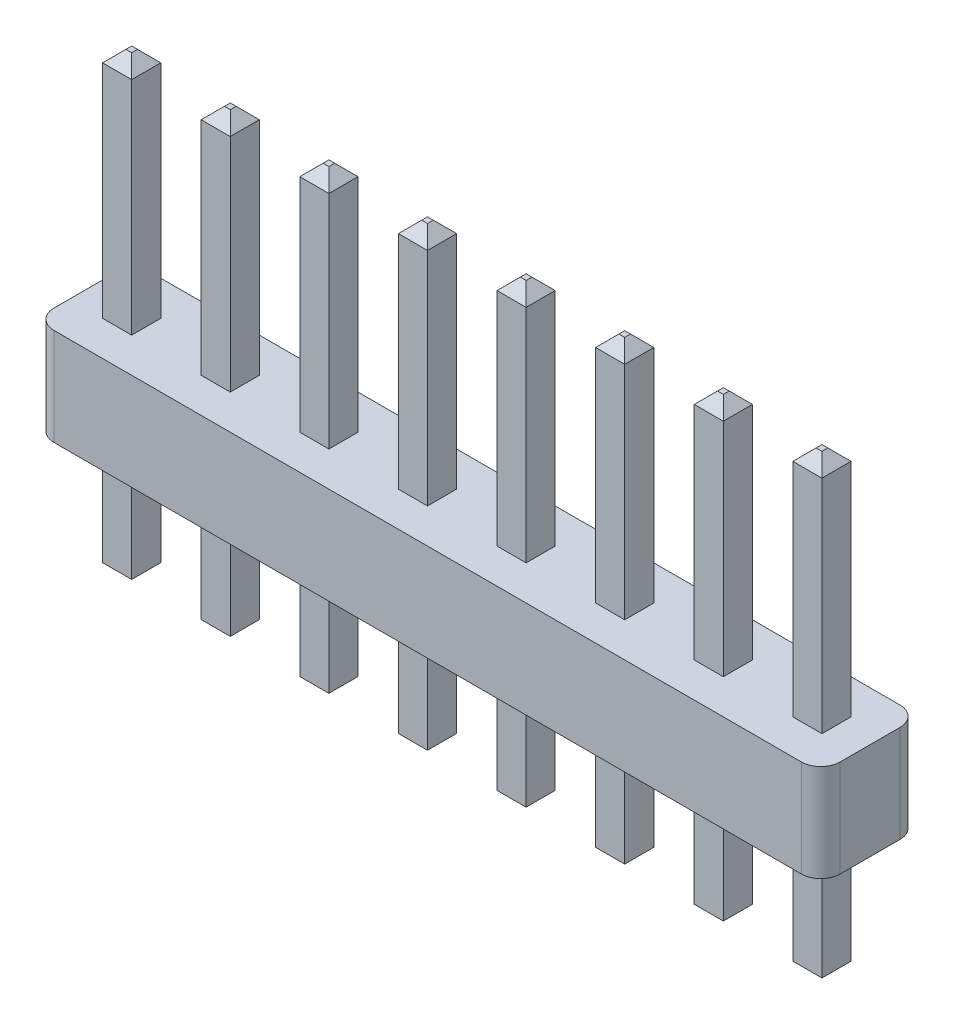
from build123d import *

# Parameters (mm, degrees)
BOSS_EXTRUDE1_DEPTH      = 2.5
BOSS_EXTRUDE2_DEPTH      = 8.5
BOSS_EXTRUDE2_DEPTH_BACK = 3.25
SKETCH2_W                = 0.75
SKETCH2_H                = 0.75
CHAMFER1_SIZE            = 0.3


with BuildPart() as part:
    # Sketch1 → Boss-Extrude1 (new body)
    with BuildSketch(Plane(origin=(0, 0, 0), x_dir=(-1, 0, 0), z_dir=(0, 1, 0))):
        with BuildLine():
            Line((-17.25, 1.27), (2, 1.27))
            ThreePointArc((2, 1.27), (2.353553391, 1.123553391), (2.5, 0.77))
            Line((2.5, 0.77), (2.5, -0.77))
            ThreePointArc((2.5, -0.77), (2.353553391, -1.123553391), (2, -1.27))
            Line((2, -1.27), (-17.25, -1.27))
            ThreePointArc((-17.25, -1.27), (-17.603553391, -1.123553391), (-17.75, -0.77))
            Line((-17.75, -0.77), (-17.75, 0.77))
            ThreePointArc((-17.75, 0.77), (-17.603553391, 1.123553391), (-17.25, 1.27))
        make_face()
    extrude(amount=BOSS_EXTRUDE1_DEPTH)

    # Sketch2 → Boss-Extrude2 (add, two sides: drawn at the far end of the back side and taken through both)
    with BuildSketch(Plane(origin=(0, 0, 0), x_dir=(-1, 0, 0), z_dir=(0, 1, 0)).offset(-BOSS_EXTRUDE2_DEPTH_BACK)):
        with Locations((1.27, 0)):
            Rectangle(SKETCH2_W, SKETCH2_H)
        with Locations((-1.27, 0)):
            Rectangle(SKETCH2_W, SKETCH2_H)
        with Locations((-3.81, 0)):
            Rectangle(SKETCH2_W, SKETCH2_H)
        with Locations((-6.35, 0)):
            Rectangle(SKETCH2_W, SKETCH2_H)
        with Locations((-8.89, 0)):
            Rectangle(SKETCH2_W, SKETCH2_H)
        with Locations((-11.43, 0)):
            Rectangle(SKETCH2_W, SKETCH2_H)
        with Locations((-13.97, 0)):
            Rectangle(SKETCH2_W, SKETCH2_H)
        with Locations((-16.51, 0)):
            Rectangle(SKETCH2_W, SKETCH2_H)
    extrude(amount=BOSS_EXTRUDE2_DEPTH + BOSS_EXTRUDE2_DEPTH_BACK)

    # Chamfer1
    chamfer1_edges = [part.edges().sort_by_distance(p)[0] for p in [
        (9.265, -3.25, 0),
        (8.89, -3.25, 0.375),
        (8.515, -3.25, 0),
        (8.89, -3.25, -0.375),
        (9.265, 8.5, 0),
        (8.89, 8.5, -0.375),
        (8.515, 8.5, 0),
        (8.89, 8.5, 0.375),
        (11.055, -3.25, 0),
        (11.43, -3.25, -0.375),
        (11.805, -3.25, 0),
        (11.43, -3.25, 0.375),
        (11.055, 8.5, 0),
        (11.43, 8.5, 0.375),
        (11.805, 8.5, 0),
        (11.43, 8.5, -0.375),
        (14.345, -3.25, 0),
        (13.97, -3.25, 0.375),
        (13.595, -3.25, 0),
        (13.97, -3.25, -0.375),
        (14.345, 8.5, 0),
        (13.97, 8.5, -0.375),
        (13.595, 8.5, 0),
        (13.97, 8.5, 0.375),
        (16.135, -3.25, 0),
        (16.51, -3.25, -0.375),
        (16.885, -3.25, 0),
        (16.51, -3.25, 0.375),
        (16.135, 8.5, 0),
        (16.51, 8.5, 0.375),
        (16.885, 8.5, 0),
        (16.51, 8.5, -0.375),
        (-0.895, -3.25, 0),
        (-1.27, -3.25, 0.375),
        (-1.645, -3.25, 0),
        (-1.27, -3.25, -0.375),
        (-0.895, 8.5, 0),
        (-1.27, 8.5, -0.375),
        (-1.645, 8.5, 0),
        (-1.27, 8.5, 0.375),
        (0.895, -3.25, 0),
        (1.27, -3.25, -0.375),
        (1.645, -3.25, 0),
        (1.27, -3.25, 0.375),
        (0.895, 8.5, 0),
        (1.27, 8.5, 0.375),
        (1.645, 8.5, 0),
        (1.27, 8.5, -0.375),
        (4.185, -3.25, 0),
        (3.81, -3.25, 0.375),
        (3.435, -3.25, 0),
        (3.81, -3.25, -0.375),
        (4.185, 8.5, 0),
        (3.81, 8.5, -0.375),
        (3.435, 8.5, 0),
        (3.81, 8.5, 0.375),
        (5.975, -3.25, 0),
        (6.35, -3.25, -0.375),
        (6.725, -3.25, 0),
        (6.35, -3.25, 0.375),
        (5.975, 8.5, 0),
        (6.35, 8.5, 0.375),
        (6.725, 8.5, 0),
        (6.35, 8.5, -0.375),
    ]]
    chamfer(chamfer1_edges, length=CHAMFER1_SIZE)


solid = part.part
